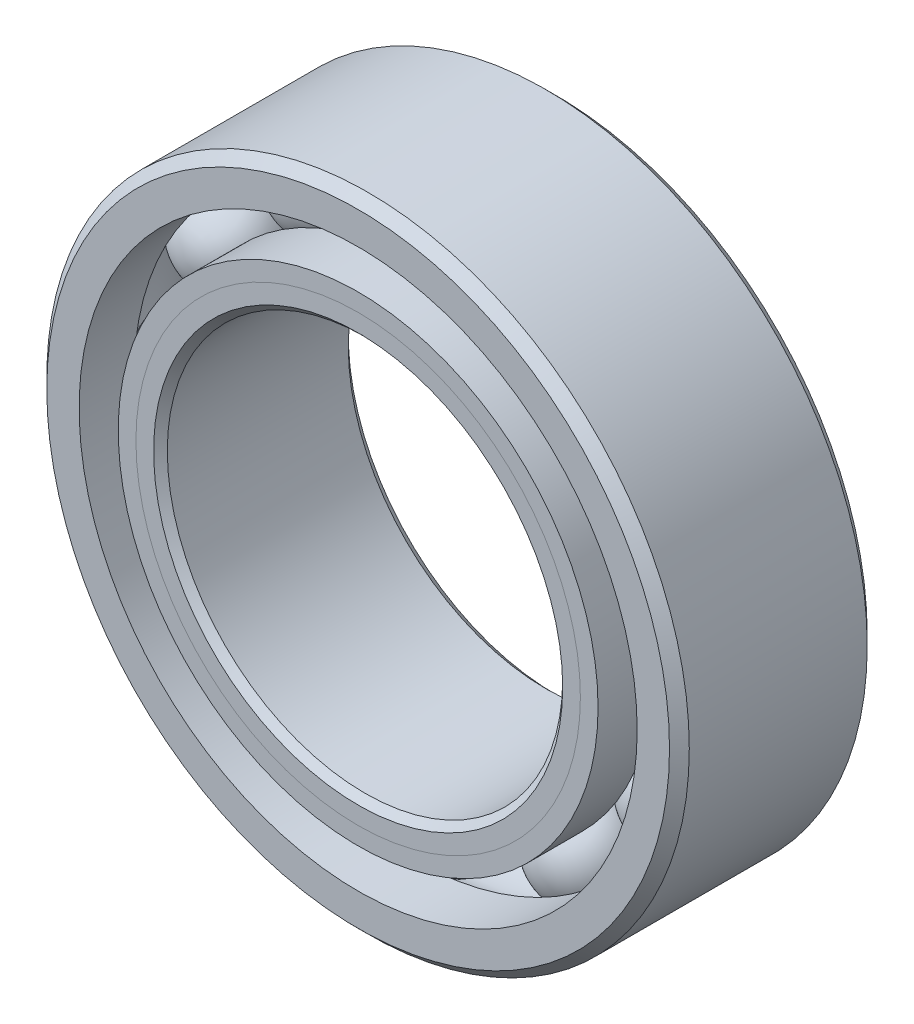
from build123d import *

# Parameters (mm, degrees)
CIRPATTERN1_COUNT = 12


with BuildPart() as part:
    # Sketch1 → Revolve1 (revolve)
    with BuildSketch(Plane(origin=(0, 0, 0), x_dir=(0, 0, -1), z_dir=(1, 0, 0))):
        with BuildLine():
            Line((5.715, 20.6375), (-5.715, 20.6375))
            Line((-5.715, 20.6375), (-6.35, 20.0025))
            Line((-6.35, 20.0025), (-6.35, 17.924793956))
            Line((-6.35, 17.924793956), (-2.822222222, 17.924793956))
            ThreePointArc((-2.822222222, 17.924793956), (0, 19.757857426), (2.822222222, 17.924793956))
            Line((2.822222222, 17.924793956), (6.35, 17.924793956))
            Line((6.35, 17.924793956), (6.35, 20.0025))
            Line((6.35, 20.0025), (5.715, 20.6375))
        make_face()
    revolve(axis=Axis((0, 0, 6.35), (0, 0, -1)))


with BuildPart() as body_2:
    # Sketch2 → Revolve2 (revolve)
    with BuildSketch(Plane(origin=(0, 0, 0), x_dir=(0, 0, -1), z_dir=(1, 0, 0))):
        with BuildLine():
            Line((-6.35, 15.412706044), (-2.822222222, 15.412706044))
            ThreePointArc((-2.822222222, 15.412706044), (-1.682636321, 14.078128511), (0, 13.579642574))
            Line((0, 13.579642574), (0, 13.139821287))
            Line((0, 13.139821287), (-5.213557621, 13.139821287))
            Line((-5.213557621, 13.139821287), (-6.35, 14.276263665))
            Line((-6.35, 14.276263665), (-6.35, 15.412706044))
        make_face()
    revolve(axis=Axis((0, 0, 6.35), (0, 0, -1)))


with BuildPart() as body_3:
    # Sketch3 → Revolve3 (revolve)
    with BuildSketch(Plane(origin=(0, 0, 0), x_dir=(0, 0, -1), z_dir=(1, 0, 0))):
        with BuildLine():
            Line((-6.35, 14.276263665), (-5.213557621, 13.139821287))
            Line((-5.213557621, 13.139821287), (0, 13.139821287))
            Line((0, 13.139821287), (0, 13.579642574))
            ThreePointArc((0, 13.579642574), (1.682636321, 14.078128511), (2.822222222, 15.412706044))
            Line((2.822222222, 15.412706044), (6.35, 15.412706044))
            Line((6.35, 15.412706044), (6.35, 13.335))
            Line((6.35, 13.335), (5.715, 12.7))
            Line((5.715, 12.7), (-5.910178713, 12.7))
            Line((-5.910178713, 12.7), (-6.35, 13.139821287))
            Line((-6.35, 13.139821287), (-6.35, 14.276263665))
        make_face()
    revolve(axis=Axis((0, 0, 6.35), (0, 0, -1)))


with BuildPart() as body_4:
    # Sketch4 → Revolve4 (revolve)
    with BuildSketch(Plane(origin=(0, 0, 0), x_dir=(0, 0, -1), z_dir=(1, 0, 0))):
        with BuildLine():
            Line((-3.089107426, 16.66875), (3.089107426, 16.66875))
            ThreePointArc((3.089107426, 16.66875), (0, 19.757857426), (-3.089107426, 16.66875))
        make_face()
    revolve(axis=Axis((0, 16.66875, 3.089107426), (0, 0, -1)))


with BuildPart() as cirpattern1_1:
    # CirPattern1: pattern copy
    add(body_4.part.rotate(Axis((0, 0, -6.35), (0, 0, 1)), 1 * 360 / CIRPATTERN1_COUNT))


with BuildPart() as cirpattern1_2:
    # CirPattern1: pattern copy
    add(body_4.part.rotate(Axis((0, 0, -6.35), (0, 0, 1)), 2 * 360 / CIRPATTERN1_COUNT))


with BuildPart() as cirpattern1_3:
    # CirPattern1: pattern copy
    add(body_4.part.rotate(Axis((0, 0, -6.35), (0, 0, 1)), 3 * 360 / CIRPATTERN1_COUNT))


with BuildPart() as cirpattern1_4:
    # CirPattern1: pattern copy
    add(body_4.part.rotate(Axis((0, 0, -6.35), (0, 0, 1)), 4 * 360 / CIRPATTERN1_COUNT))


with BuildPart() as cirpattern1_5:
    # CirPattern1: pattern copy
    add(body_4.part.rotate(Axis((0, 0, -6.35), (0, 0, 1)), 5 * 360 / CIRPATTERN1_COUNT))


with BuildPart() as cirpattern1_6:
    # CirPattern1: pattern copy
    add(body_4.part.rotate(Axis((0, 0, -6.35), (0, 0, 1)), 6 * 360 / CIRPATTERN1_COUNT))


with BuildPart() as cirpattern1_7:
    # CirPattern1: pattern copy
    add(body_4.part.rotate(Axis((0, 0, -6.35), (0, 0, 1)), 7 * 360 / CIRPATTERN1_COUNT))


with BuildPart() as cirpattern1_8:
    # CirPattern1: pattern copy
    add(body_4.part.rotate(Axis((0, 0, -6.35), (0, 0, 1)), 8 * 360 / CIRPATTERN1_COUNT))


with BuildPart() as cirpattern1_9:
    # CirPattern1: pattern copy
    add(body_4.part.rotate(Axis((0, 0, -6.35), (0, 0, 1)), 9 * 360 / CIRPATTERN1_COUNT))


with BuildPart() as cirpattern1_10:
    # CirPattern1: pattern copy
    add(body_4.part.rotate(Axis((0, 0, -6.35), (0, 0, 1)), 10 * 360 / CIRPATTERN1_COUNT))


with BuildPart() as cirpattern1_11:
    # CirPattern1: pattern copy
    add(body_4.part.rotate(Axis((0, 0, -6.35), (0, 0, 1)), 11 * 360 / CIRPATTERN1_COUNT))


solid = Compound([part.part, body_2.part, body_3.part, body_4.part, cirpattern1_1.part, cirpattern1_2.part, cirpattern1_3.part, cirpattern1_4.part, cirpattern1_5.part, cirpattern1_6.part, cirpattern1_7.part, cirpattern1_8.part, cirpattern1_9.part, cirpattern1_10.part, cirpattern1_11.part])
